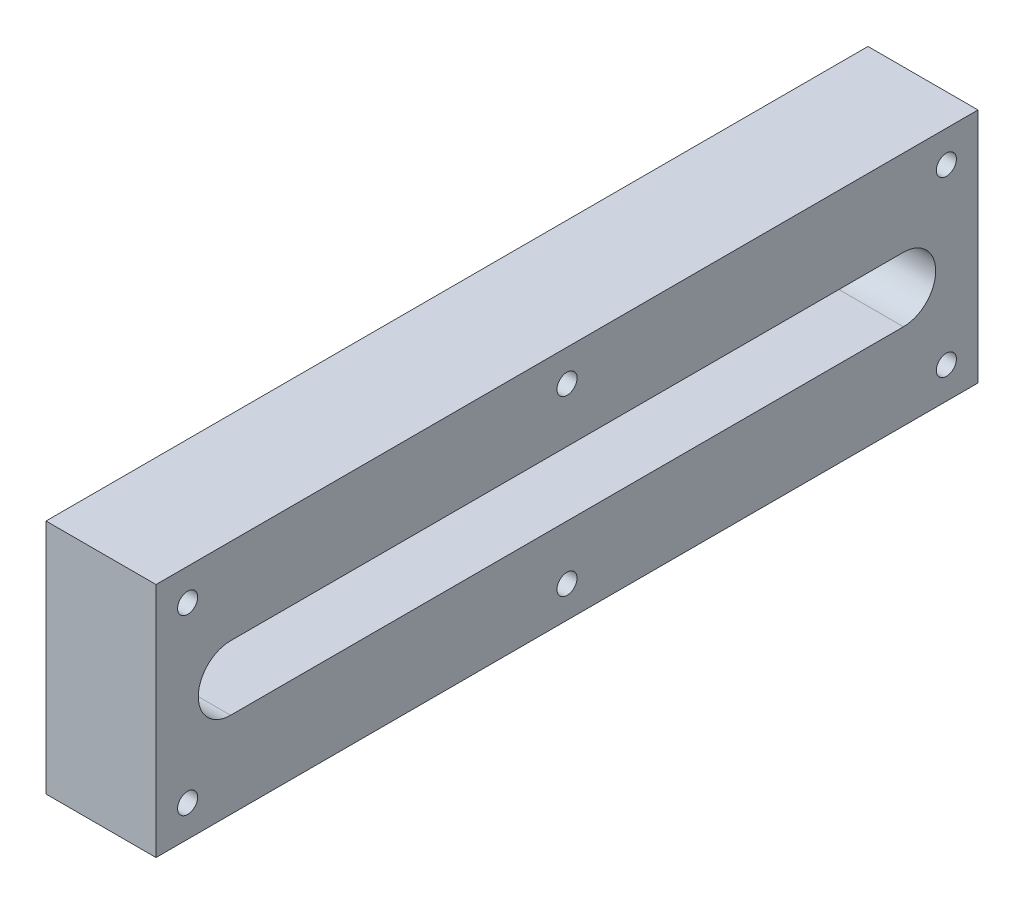
from build123d import *

# Parameters (mm, degrees)
SKETCH1_W              = 165.1
SKETCH1_H              = 47.498
BOSS_EXTRUDE1_DEPTH    = 22.098
CUT_EXTRUDE1_DEPTH     = 18.249011
F_10_32_TAPPED_HOLE1_D = 4.0386


with BuildPart() as part:
    # Sketch1 → Boss-Extrude1 (new body)
    with BuildSketch(Plane(origin=(0, 0, 0), x_dir=(0, 0, -1), z_dir=(1, 0, 0))):
        Rectangle(SKETCH1_W, SKETCH1_H)
        with BuildLine():
            Line((-67.5752522, 2.5527), (67.5752522, 2.5527))
            ThreePointArc((67.5752522, 2.5527), (70.1279522, 0), (67.5752522, -2.5527))
            Line((67.5752522, -2.5527), (-67.5752522, -2.5527))
            ThreePointArc((-67.5752522, -2.5527), (-70.1279522, 0), (-67.5752522, 2.5527))
        make_face(mode=Mode.SUBTRACT)
    extrude(amount=BOSS_EXTRUDE1_DEPTH)

    # Sketch2 → Cut-Extrude1 (cut)
    with BuildSketch(Plane(origin=(22.098, 0, 0), x_dir=(0, 0, -1), z_dir=(1, 0, 0))):
        with BuildLine():
            Line((-67.5752522, 6.4797559), (67.5752522, 6.4797559))
            ThreePointArc((67.5752522, 6.4797559), (74.0550081, 0), (67.5752522, -6.4797559))
            Line((67.5752522, -6.4797559), (-67.5752522, -6.4797559))
            ThreePointArc((-67.5752522, -6.4797559), (-74.0550081, 0), (-67.5752522, 6.4797559))
        make_face()
    extrude(amount=-CUT_EXTRUDE1_DEPTH, mode=Mode.SUBTRACT)

    # #10-32 Tapped Hole1 (through all)
    with Locations(Plane(origin=(22.098, 0, 0), x_dir=(0, 0, -1), z_dir=(1, 0, 0))):
        with Locations((-76.2, 17.399), (-76.2, -17.399), (0, -17.399), (76.2, -17.399), (76.2, 17.399), (0, 17.399)):
            Hole(F_10_32_TAPPED_HOLE1_D / 2)


solid = part.part
